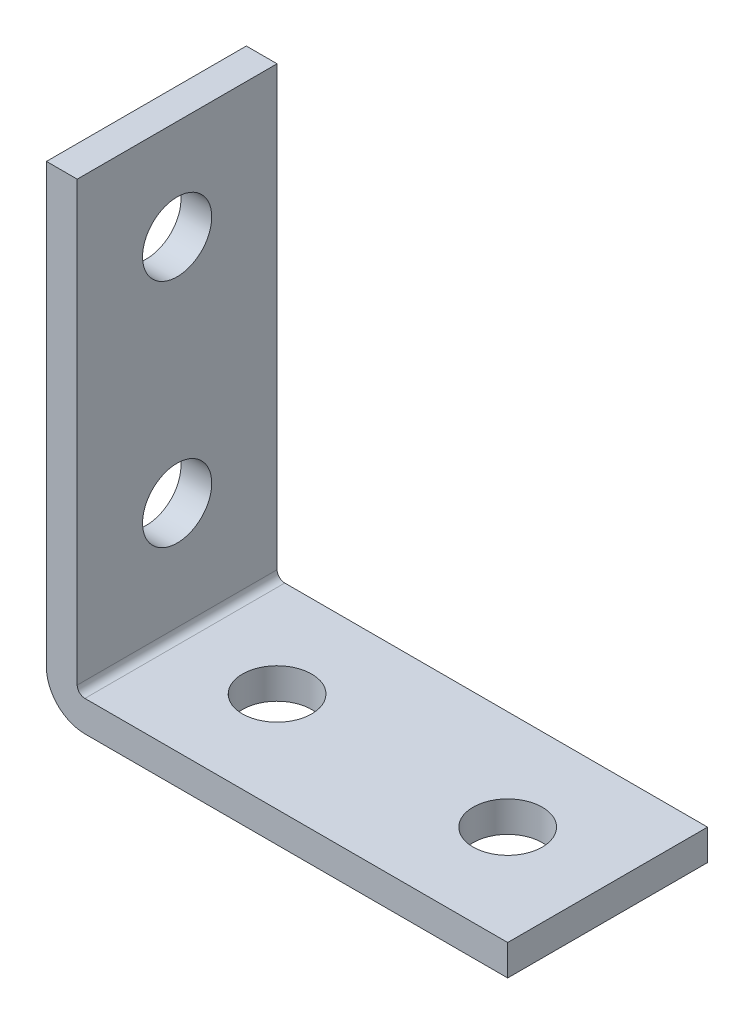
from build123d import *

# Parameters (mm, degrees)
EXTRUDE_THIN1_DEPTH = 20.6375
SKETCH2_R           = 7.14375
CUT_EXTRUDE1_DEPTH  = 135.075629893
SKETCH3_R           = 7.14375
CUT_EXTRUDE2_DEPTH  = 135.225917882


with BuildPart() as part:
    # Sketch1 → Extrude-Thin1 (new, symmetric)
    with BuildSketch(Plane.XY):
        with BuildLine():
            Line((0, 98.425), (0, 7.9375))
            ThreePointArc((0, 7.9375), (2.324839924, 2.324839924), (7.9375, 0))
            Line((7.9375, 0), (95.25, 0))
            Line((95.25, 0), (95.25, 6.35))
            Line((95.25, 6.35), (7.9375, 6.35))
            ThreePointArc((7.9375, 6.35), (6.814967985, 6.814967985), (6.35, 7.9375))
            Line((6.35, 7.9375), (6.35, 98.425))
            Line((6.35, 98.425), (0, 98.425))
        make_face()
    extrude(amount=EXTRUDE_THIN1_DEPTH, both=True)

    # Sketch2 → Cut-Extrude1 (cut, through all)
    with BuildSketch(Plane(origin=(0, 6.35, 0), x_dir=(1, 0, 0), z_dir=(0, 1, 0))):
        with Locations(Location((74.6125, 0, 0), (0, 0, 270))):
            Circle(SKETCH2_R)
        with Locations(Location((26.9875, 0, 0), (0, 0, 270))):
            Circle(SKETCH2_R)
    extrude(amount=-CUT_EXTRUDE1_DEPTH, mode=Mode.SUBTRACT)

    # Sketch3 → Cut-Extrude2 (cut, through all)
    with BuildSketch(Plane(origin=(6.35, 0, 0), x_dir=(0, 0, -1), z_dir=(1, 0, 0))):
        with Locations(Location((0, 77.7875, 0), (0, 0, 90))):
            Circle(SKETCH3_R)
        with Locations(Location((0, 30.1625, 0), (0, 0, 90))):
            Circle(SKETCH3_R)
    extrude(amount=-CUT_EXTRUDE2_DEPTH, mode=Mode.SUBTRACT)


solid = part.part
